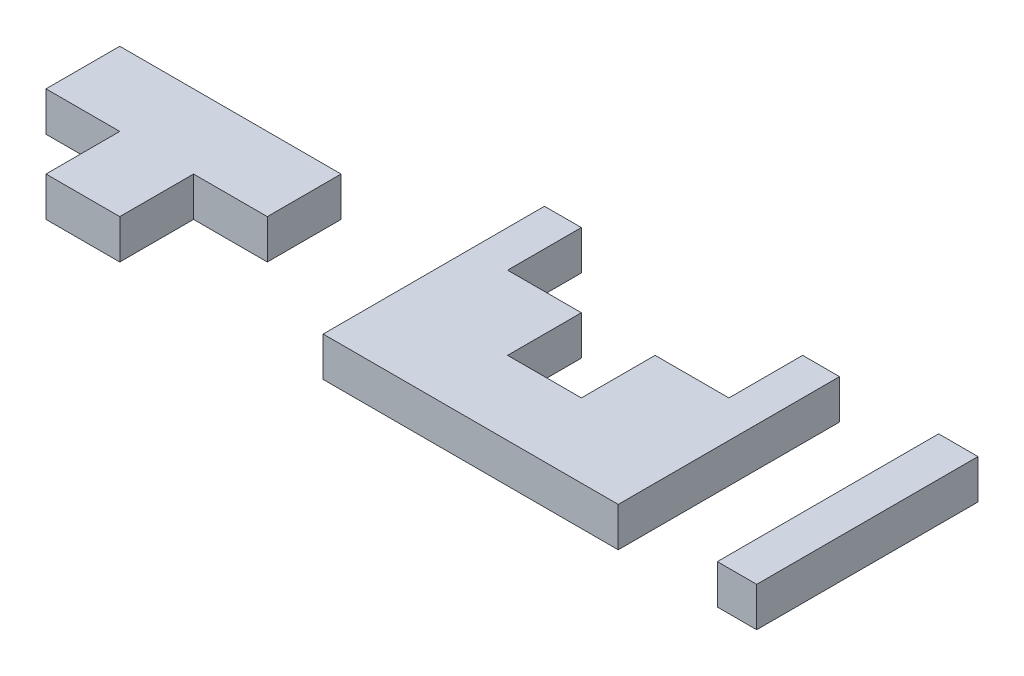
from build123d import *

# Parameters (mm, degrees)
BOSS_EXTRUDE1_DEPTH   = 8
BOSS_EXTRUDE1_2_DEPTH = 8
SKETCH1_W             = 8
SKETCH1_H             = 45
BOSS_EXTRUDE1_3_DEPTH = 8


with BuildPart() as part:
    # Sketch1 → Boss-Extrude1 (new body)
    with BuildSketch(Plane(origin=(0, 0, 0), x_dir=(1, 0, 0), z_dir=(0, 1, 0))):
        Polygon((-31.331592689, 0), (-16.331592689, 0), (-16.331592689, 15), (-1.331592689, 15), (-1.331592689, 30), (-46.331592689, 30), (-46.331592689, 15), (-31.331592689, 15), align=None)
    extrude(amount=BOSS_EXTRUDE1_DEPTH)


with BuildPart() as body_2:
    # Sketch1 → Boss-Extrude1 2 (new body)
    with BuildSketch(Plane(origin=(0, 0, 0), x_dir=(1, 0, 0), z_dir=(0, 1, 0))):
        Polygon((25.026109661, 45), (25.026109661, 0), (85.026109661, 0), (85.026109661, 45), (77.526109661, 45), (77.526109661, 30), (62.526109661, 30), (62.526109661, 15), (47.526109661, 15), (47.526109661, 30), (32.526109661, 30), (32.526109661, 45), align=None)
    extrude(amount=BOSS_EXTRUDE1_2_DEPTH)


with BuildPart() as body_3:
    # Sketch1 → Boss-Extrude1 3 (new body)
    with BuildSketch(Plane(origin=(0, 0, 0), x_dir=(1, 0, 0), z_dir=(0, 1, 0))):
        with Locations((109.177341044, 22.5)):
            Rectangle(SKETCH1_W, SKETCH1_H)
    extrude(amount=BOSS_EXTRUDE1_3_DEPTH)


solid = Compound([part.part, body_2.part, body_3.part])
